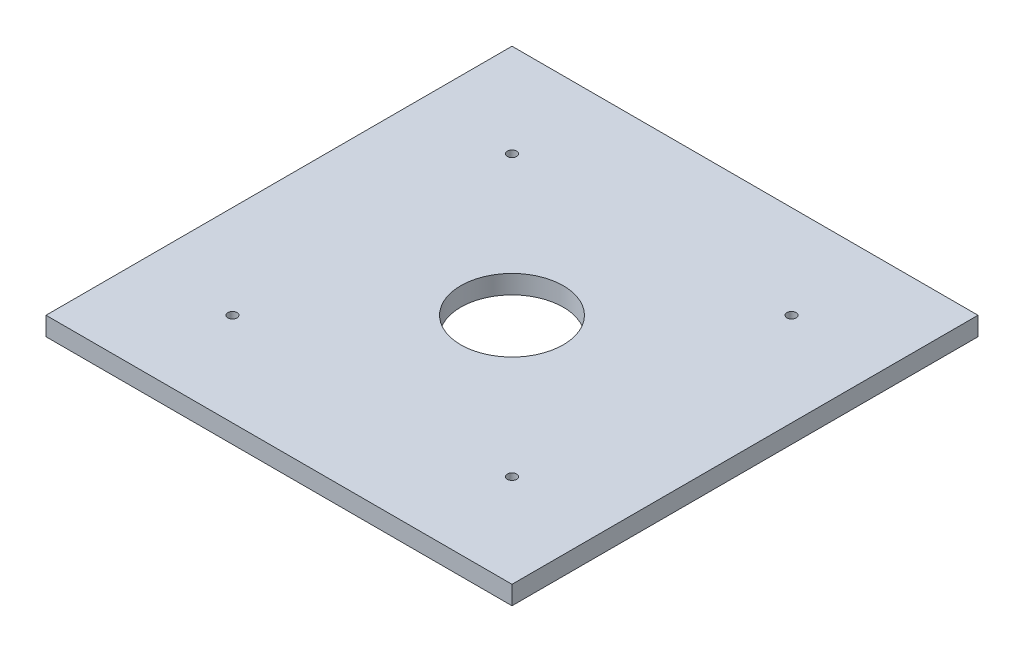
from build123d import *

# Parameters (mm, degrees)
SKETCH1_W           = 500
SKETCH1_H           = 500
SKETCH1_R           = 55
SKETCH1_R_2         = 5
BOSS_EXTRUDE1_DEPTH = 10


with BuildPart() as part:
    # Sketch1 → Boss-Extrude1 (new, symmetric)
    with BuildSketch(Plane(origin=(0, 0, 0), x_dir=(1, 0, 0), z_dir=(0, 1, 0))):
        Rectangle(SKETCH1_W, SKETCH1_H)
        with Locations(Location((0, 0, 0), (0, 0, 270))):
            Circle(SKETCH1_R, mode=Mode.SUBTRACT)
        with Locations(Location((-150, 150, 0), (0, 0, 270))):
            Circle(SKETCH1_R_2, mode=Mode.SUBTRACT)
        with Locations(Location((150, 150, 0), (0, 0, 270))):
            Circle(SKETCH1_R_2, mode=Mode.SUBTRACT)
        with Locations(Location((-150, -150, 0), (0, 0, 270))):
            Circle(SKETCH1_R_2, mode=Mode.SUBTRACT)
        with Locations(Location((150, -150, 0), (0, 0, 270))):
            Circle(SKETCH1_R_2, mode=Mode.SUBTRACT)
    extrude(amount=BOSS_EXTRUDE1_DEPTH, both=True)


solid = part.part
